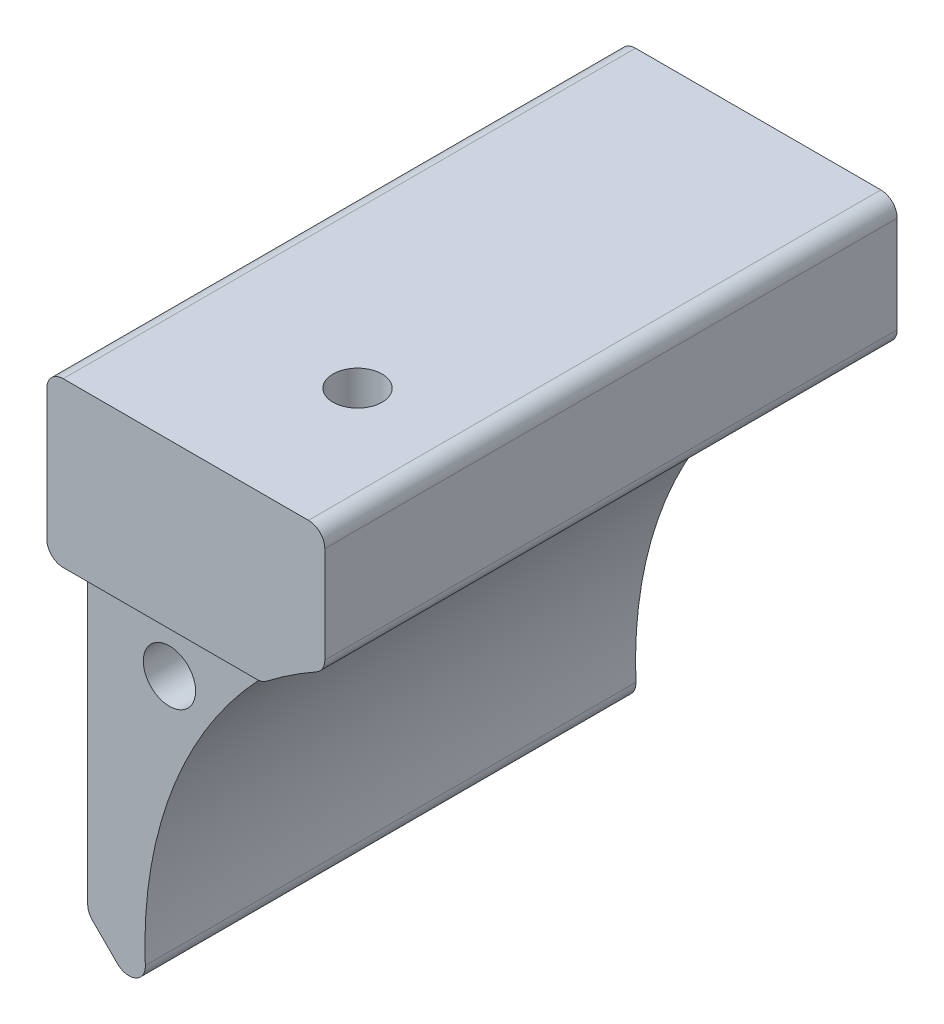
from build123d import *

# Parameters (mm, degrees)
SKETCH1_R           = 2.032
BOSS_EXTRUDE1_DEPTH = 19.05
BOSS_EXTRUDE2_START = 3.175
BOSS_EXTRUDE2_DEPTH = 3.175
FILLET1_R           = 1.27
SKETCH3_R           = 1.905
CUT_EXTRUDE1_DEPTH  = 52.21483461447027


with BuildPart() as part:
    # Sketch1 → Boss-Extrude1 (new, symmetric)
    # profile 1 of 2: a face of its own
    with BuildSketch(Plane.XY):
        with BuildLine():
            Line((0, 50.8), (0, 25.40000000000009))
            Line((0, 25.40000000000009), (4.803171045006462, 20.59682895499363))
            ThreePointArc((4.803171045006465, 20.59682895499363), (7.897944154578656, 39.95075151177493), (21.589999999999996, 53.97499999999999))
            Line((21.589999999999996, 53.974999999999994), (21.589999999999996, 63.5))
            Line((21.589999999999996, 63.5), (0, 63.5))
            Line((0, 63.5), (0, 50.8))
        make_face()
        with Locations(Location((6.35, 44.449999999999996, 0), (0, 0, 180))):
            Circle(SKETCH1_R, mode=Mode.SUBTRACT)
    # profile 2 of 2: a face of its own
    with BuildSketch(Plane.XY):
        with BuildLine():
            Line((0, 50.8), (0, 25.40000000000009))
            Line((0, 25.40000000000009), (4.803171045006462, 20.59682895499363))
            ThreePointArc((4.803171045006465, 20.59682895499363), (7.897944154578656, 39.95075151177493), (21.589999999999996, 53.97499999999999))
            Line((21.589999999999996, 53.974999999999994), (21.589999999999996, 63.5))
            Line((21.589999999999996, 63.5), (0, 63.5))
            Line((0, 63.5), (0, 50.8))
        make_face()
        with Locations(Location((6.35, 44.449999999999996, 0), (0, 0, 180))):
            Circle(SKETCH1_R, mode=Mode.SUBTRACT)
    extrude(amount=BOSS_EXTRUDE1_DEPTH, both=True)

    # Sketch2 → Boss-Extrude2 (add)
    with BuildSketch(Plane.XY.offset(19.05).offset(BOSS_EXTRUDE2_START)):
        with BuildLine():
            Line((0, 63.5), (21.589999999999996, 63.5))
            Line((21.589999999999996, 63.5), (21.589999999999996, 53.974999999999994))
            ThreePointArc((21.589999999999996, 53.974999999999994), (19.09356210818939, 52.4962542782198), (16.7394991351634, 50.8))
            Line((16.7394991351634, 50.8), (1.56e-15, 50.8))
            Line((1.56e-15, 50.8), (0, 63.5))
        make_face()
    boss_extrude2 = extrude(amount=-BOSS_EXTRUDE2_DEPTH)

    # Mirror1: Boss-Extrude2 across plane
    add(boss_extrude2.mirror(Plane.XY))

    # Fillet1
    fillet1_edges = [part.edges().sort_by_distance(p)[0] for p in [
        (4.803171045006463, 20.59682895499363, 0),
        (0, 25.40000000000009, 0),
        (0, 63.5, 0),
        (21.589999999999996, 63.5, 0),
        (21.589999999999996, 53.974999999999994, 0),
        (1.56e-15, 50.8, 20.637500000000003),
        (16.7394991351634, 50.8, 20.637500000000003),
        (1.56e-15, 50.8, -20.637500000000003),
        (16.7394991351634, 50.8, -20.637500000000003),
    ]]
    fillet(fillet1_edges, radius=FILLET1_R)

    # Sketch3 → Cut-Extrude1 (cut, through all)
    with BuildSketch(Plane(origin=(0, 63.5, 0), x_dir=(1, 0, 0), z_dir=(0, 1, 0))):
        with Locations(Location((13.335, -11.430000000000003, 0), (0, 0, 270))):
            Circle(SKETCH3_R)
    extrude(amount=-CUT_EXTRUDE1_DEPTH, mode=Mode.SUBTRACT)


solid = part.part
